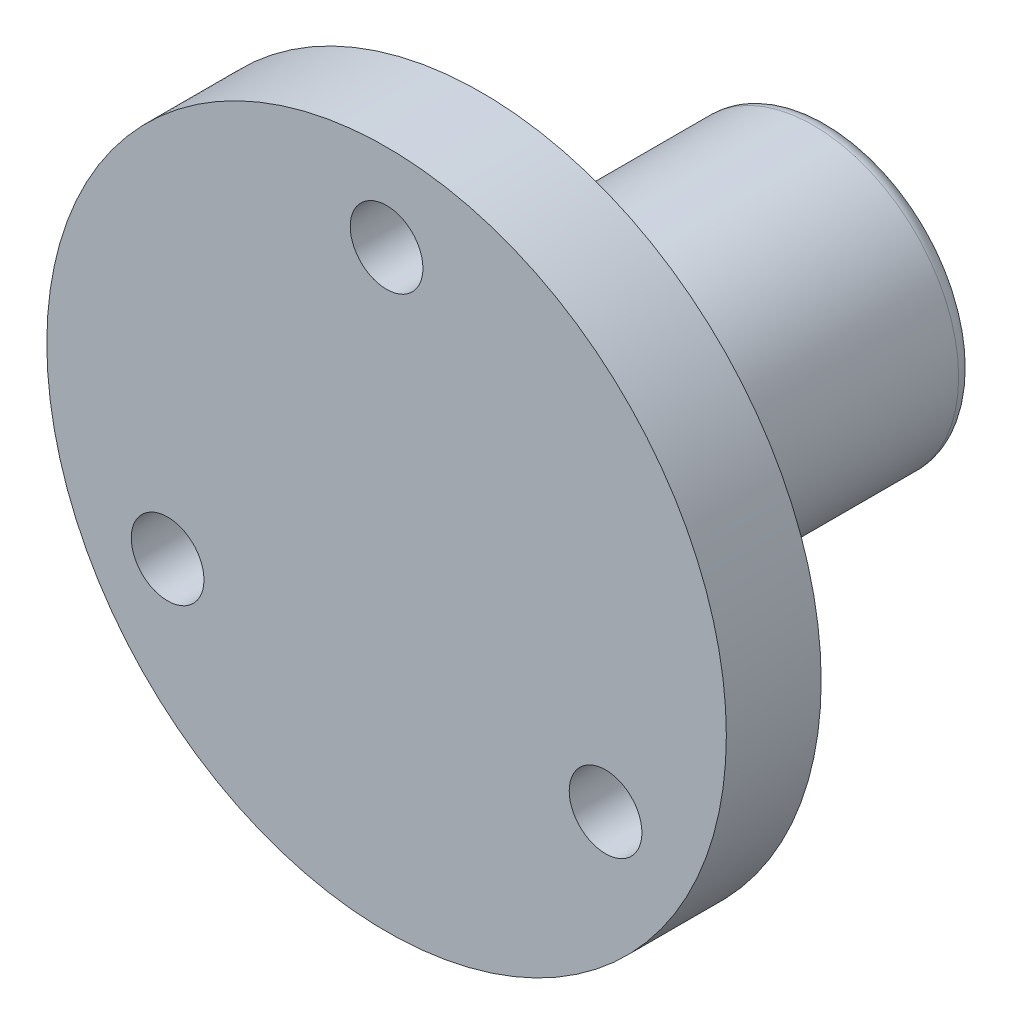
from build123d import *

# Parameters (mm, degrees)
SKETCH1_R           = 4.6
BOSS_EXTRUDE1_DEPTH = 11
SKETCH2_R           = 10.75
SKETCH2_R_2         = 1.15
BOSS_EXTRUDE2_DEPTH = 3
CUT_EXTRUDE1_DEPTH  = 1
CHAMFER1_SIZE       = 1
FILLET1_R           = 0.5


with BuildPart() as part:
    # Sketch1 → Boss-Extrude1 (new body)
    with BuildSketch(Plane.XY):
        with Locations((19.925, -7)):
            Circle(SKETCH1_R)
        with BuildLine():
            Line((18.087719777, -4.503121672), (21.762280223, -4.503121672))
            ThreePointArc((21.762280223, -4.503121672), (19.925, -10.1), (18.087719777, -4.503121672))
        make_face(mode=Mode.SUBTRACT)
    extrude(amount=-BOSS_EXTRUDE1_DEPTH)

    # Sketch2 → Boss-Extrude2 (add)
    with BuildSketch(Plane.XY):
        with Locations((19.925, -7)):
            Circle(SKETCH2_R)
        with Locations((19.925, 1)):
            Circle(SKETCH2_R_2, mode=Mode.SUBTRACT)
        with Locations((12.99679677, -11)):
            Circle(SKETCH2_R_2, mode=Mode.SUBTRACT)
        with Locations((26.85320323, -11)):
            Circle(SKETCH2_R_2, mode=Mode.SUBTRACT)
    extrude(amount=BOSS_EXTRUDE2_DEPTH)

    # Sketch3 → Cut-Extrude1 (cut)
    with BuildSketch(Plane(origin=(0, 0, 0), x_dir=(-1, 0, 0), z_dir=(0, 0, -1))):
        Polygon((-25.554165125, -8.75), (-28.152241336, -8.75), (-29.451279442, -11), (-28.152241336, -13.25), (-25.554165125, -13.25), (-24.255127019, -11), align=None)
        Polygon((-22.523076211, 1), (-21.224038106, -1.25), (-18.625961894, -1.25), (-17.326923789, 1), (-18.625961894, 3.25), (-21.224038106, 3.25), align=None)
        Polygon((-14.295834875, -8.75), (-15.594872981, -11), (-14.295834875, -13.25), (-11.697758664, -13.25), (-10.398720558, -11), (-11.697758664, -8.75), align=None)
    extrude(amount=-CUT_EXTRUDE1_DEPTH, mode=Mode.SUBTRACT)

    # Chamfer1
    chamfer1_edges = [part.edges().sort_by_distance(p)[0] for p in [
        (15.325, -7, 0),
    ]]
    chamfer(chamfer1_edges, length=CHAMFER1_SIZE)

    # Fillet1
    fillet1_edges = [part.edges().sort_by_distance(p)[0] for p in [
        (15.325, -7, -11),
    ]]
    fillet(fillet1_edges, radius=FILLET1_R)


solid = part.part
